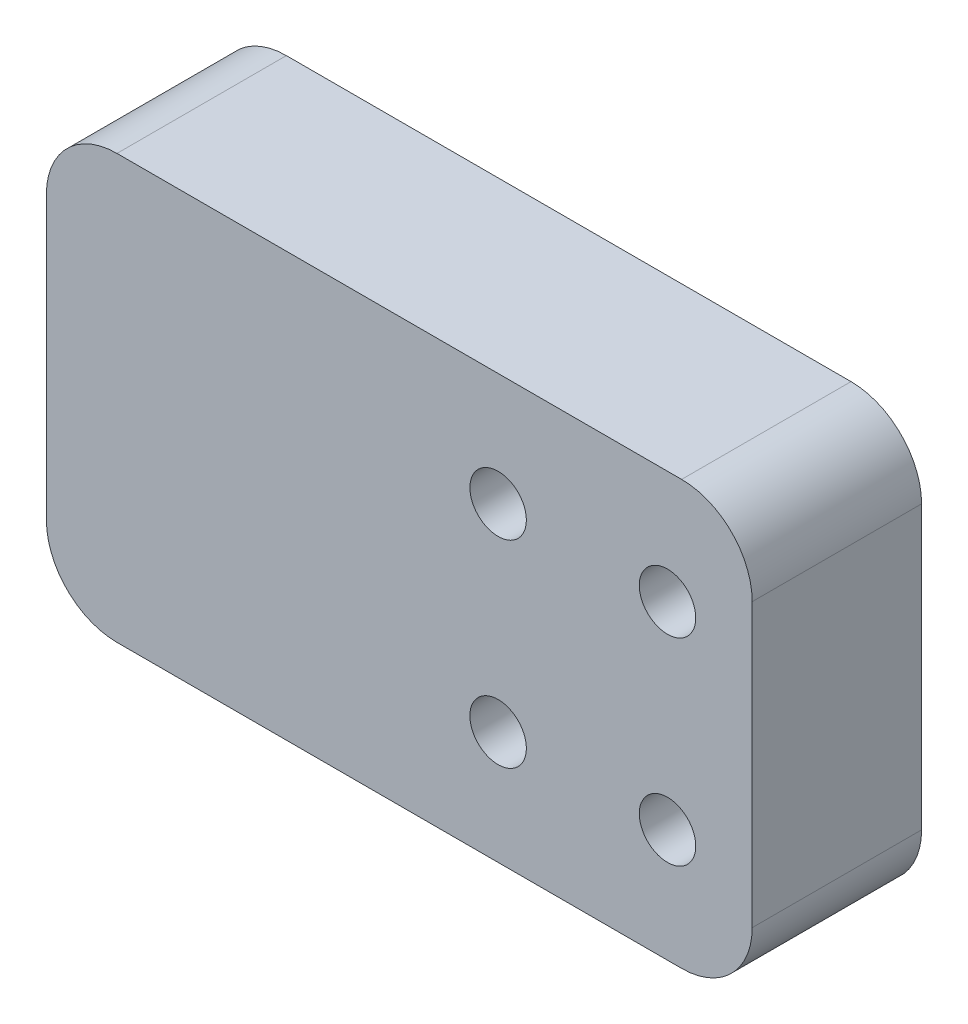
from build123d import *

# Parameters (mm, degrees)
SKETCH_1_W          = 50
SKETCH_1_H          = 30
EXTRUDE_1_DEPTH     = 12
SKETCH_2_R          = 2
CUT_EXTRUDE_1_DEPTH = 12
FILLET_1_R          = 5


with BuildPart() as part:
    # 草图1 → 凸台-拉伸1 (new body)
    with BuildSketch(Plane.XY):
        with Locations((25, 15)):
            Rectangle(SKETCH_1_W, SKETCH_1_H)
    extrude(amount=-EXTRUDE_1_DEPTH)

    # 草图2 → 切除-拉伸1 (cut)
    with BuildSketch(Plane.XY):
        with Locations((44, 22)):
            Circle(SKETCH_2_R)
        with Locations(Location((44, 8, 0), (0, 0, 180))):
            Circle(SKETCH_2_R)
        with Locations((32, 22)):
            Circle(SKETCH_2_R)
        with Locations(Location((32, 8, 0), (0, 0, 180))):
            Circle(SKETCH_2_R)
    extrude(amount=-CUT_EXTRUDE_1_DEPTH, mode=Mode.SUBTRACT)

    # 圆角1
    fillet_1_edges = [part.edges().sort_by_distance(p)[0] for p in [
        (0, 30, -6),
        (50, 30, -6),
        (50, 0, -6),
        (0, 0, -6),
    ]]
    fillet(fillet_1_edges, radius=FILLET_1_R)


solid = part.part
